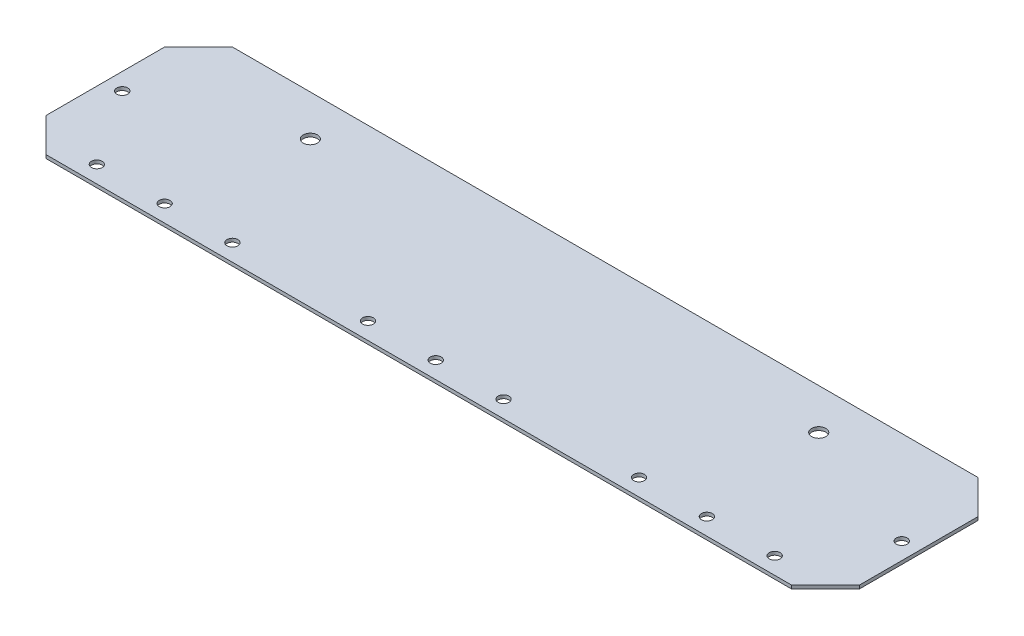
from build123d import *

# Parameters (mm, degrees)
SKETCH_1_W          = 240
SKETCH_1_H          = 55
EXTRUDE_1_DEPTH     = 1
CHAMFER_1_SIZE      = 10
SKETCH_2_R          = 2.1
SKETCH_2_R_2        = 1.6
CUT_EXTRUDE_1_DEPTH = 10


with BuildPart() as part:
    # 草图1 → 凸台-拉伸1 (new body)
    with BuildSketch(Plane(origin=(0, 0, 0), x_dir=(1, 0, 0), z_dir=(0, 1, 0))):
        with Locations((120, 27.5)):
            Rectangle(SKETCH_1_W, SKETCH_1_H)
    extrude(amount=EXTRUDE_1_DEPTH)

    # 倒角1
    chamfer_1_edges = [part.edges().sort_by_distance(p)[0] for p in [
        (0, 0.5, -55),
        (240, 0.5, -55),
        (240, 0.5, 0),
        (0, 0.5, 0),
    ]]
    chamfer(chamfer_1_edges, length=CHAMFER_1_SIZE)

    # 草图2 → 切除-拉伸1 (cut)
    with BuildSketch(Plane.XZ):
        with Locations(Location((195, -43, 0), (0, 0, 270))):
            Circle(SKETCH_2_R)
        with Locations(Location((45, -43, 0), (0, 0, 270))):
            Circle(SKETCH_2_R)
        with Locations(Location((235, -27.5, 0), (0, 0, 270))):
            Circle(SKETCH_2_R_2)
        with Locations(Location((5, -27.5, 0), (0, 0, 270))):
            Circle(SKETCH_2_R_2)
        with Locations(Location((20, -5, 0), (0, 0, 270))):
            Circle(SKETCH_2_R_2)
        with Locations(Location((60, -5, 0), (0, 0, 270))):
            Circle(SKETCH_2_R_2)
        with Locations(Location((100, -5, 0), (0, 0, 270))):
            Circle(SKETCH_2_R_2)
        with Locations(Location((140, -5, 0), (0, 0, 270))):
            Circle(SKETCH_2_R_2)
        with Locations(Location((180, -5, 0), (0, 0, 270))):
            Circle(SKETCH_2_R_2)
        with Locations(Location((220, -5, 0), (0, 0, 270))):
            Circle(SKETCH_2_R_2)
        with Locations(Location((40, -5, 0), (0, 0, 270))):
            Circle(SKETCH_2_R_2)
        with Locations(Location((120, -5, 0), (0, 0, 270))):
            Circle(SKETCH_2_R_2)
        with Locations(Location((200, -5, 0), (0, 0, 270))):
            Circle(SKETCH_2_R_2)
    extrude(amount=-CUT_EXTRUDE_1_DEPTH, mode=Mode.SUBTRACT)


solid = part.part
